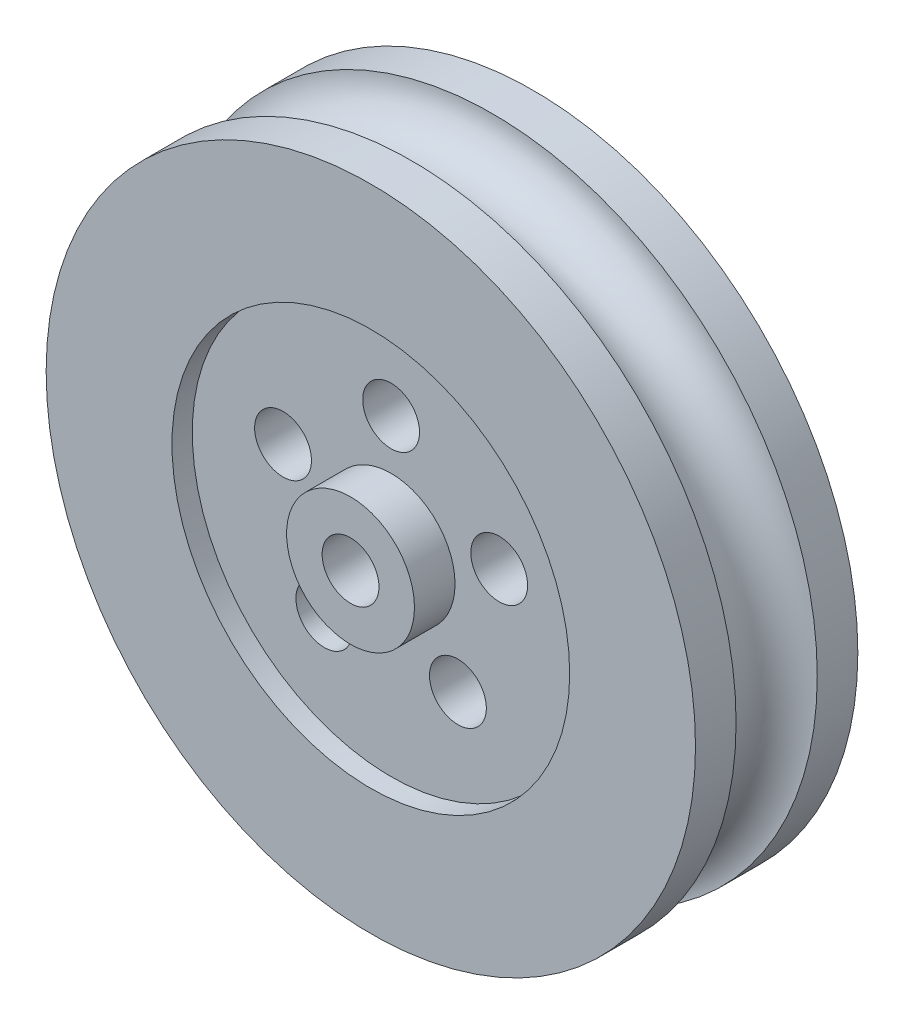
from build123d import *

# Parameters (mm, degrees)
SKETCH2_R           = 16
SKETCH2_R_2         = 1.4
BOSS_EXTRUDE1_DEPTH = 4
SKETCH3_R           = 9.8
CUT_EXTRUDE1_DEPTH  = 1
SKETCH6_R           = 3.15
SKETCH6_R_2         = 1.4
BOSS_EXTRUDE2_DEPTH = 2
SKETCH4_R           = 1.4
CUT_EXTRUDE2_DEPTH  = 25
CIRPATTERN1_COUNT   = 5
SKETCH5_R           = 2


with BuildPart() as part:
    # Sketch2 → Boss-Extrude1 (new, symmetric)
    with BuildSketch(Plane.XY):
        Circle(SKETCH2_R)
        Circle(SKETCH2_R_2, mode=Mode.SUBTRACT)
    extrude(amount=BOSS_EXTRUDE1_DEPTH, both=True)

    # Sketch3 → Cut-Extrude1 (cut)
    with BuildSketch(Plane.XY.offset(4)):
        Circle(SKETCH3_R)
    cut_extrude1 = extrude(amount=-CUT_EXTRUDE1_DEPTH, mode=Mode.SUBTRACT)

    # Sketch6 → Boss-Extrude2 (add)
    with BuildSketch(Plane.XY.offset(3)):
        Circle(SKETCH6_R)
        Circle(SKETCH6_R_2, mode=Mode.SUBTRACT)
    boss_extrude2 = extrude(amount=BOSS_EXTRUDE2_DEPTH)

    # Mirror1: Cut-Extrude1, Boss-Extrude2 across plane
    add(cut_extrude1.mirror(Plane.XY), mode=Mode.SUBTRACT)
    add(boss_extrude2.mirror(Plane.XY))

    # Sketch4 → Cut-Extrude2 (cut, through all)
    with BuildSketch(Plane.XY.offset(3)):
        with Locations((0, 5.6)):
            Circle(SKETCH4_R)
    cut_extrude2 = extrude(amount=-CUT_EXTRUDE2_DEPTH, mode=Mode.SUBTRACT)

    # CirPattern1: Cut-Extrude2 ×5 about axis
    cirpattern1_axis = Axis((0, 0, 0), (0, 0, 1))
    for i in range(1, CIRPATTERN1_COUNT):
        add(cut_extrude2.rotate(cirpattern1_axis, i * 360 / CIRPATTERN1_COUNT), mode=Mode.SUBTRACT)

    # Sketch5 → Cut-Revolve1 (revolve, cut)
    with BuildSketch(Plane(origin=(0, 0, 0), x_dir=(1, 0, 0), z_dir=(0, 1, 0)), mode=Mode.PRIVATE) as cut_revolve1_sk:
        with Locations((16, 0)):
            Circle(SKETCH5_R)
    revolve(cut_revolve1_sk.sketch.rotate(Axis((0, 0, -19.267509915), (0, 0, 1)), 180), axis=Axis((0, 0, -19.267509915), (0, 0, 1)), mode=Mode.SUBTRACT)


solid = part.part
